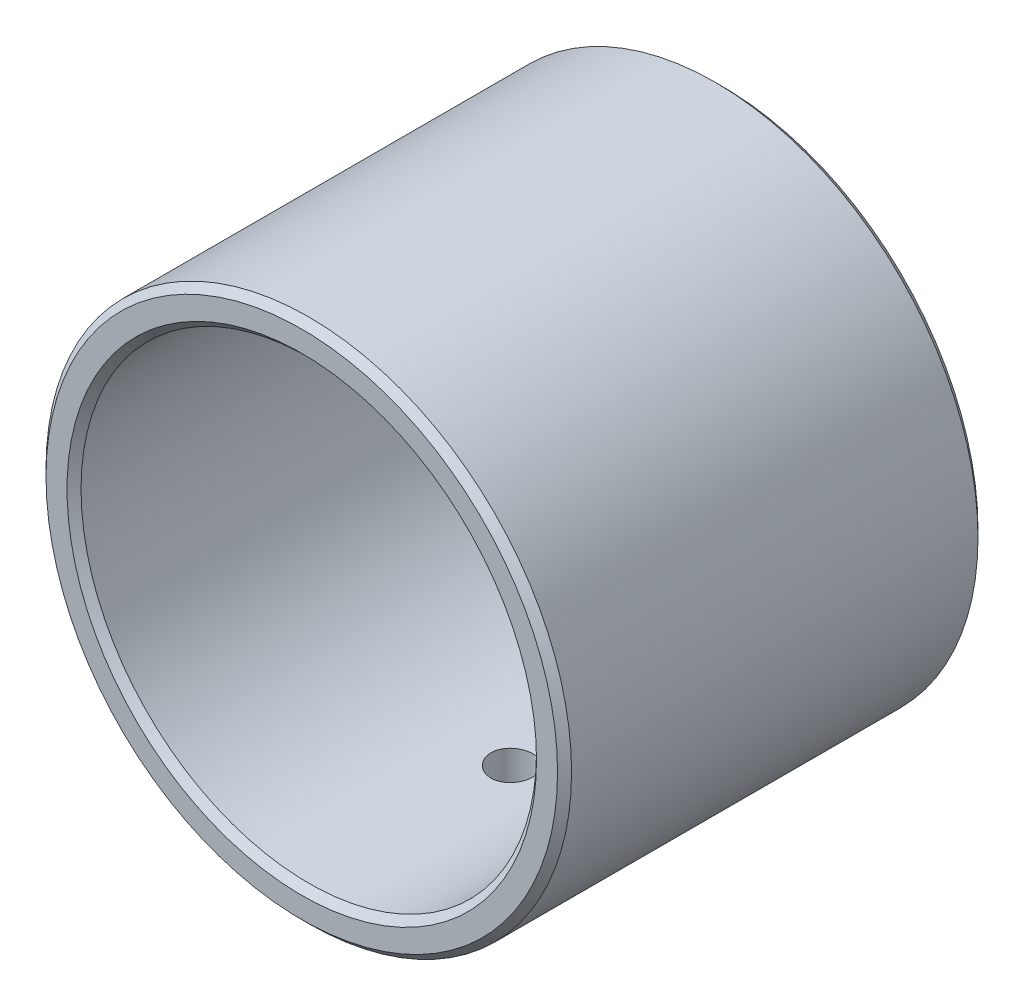
from build123d import *

# Parameters (mm, degrees)
SKETCH_1_R          = 37.5
SKETCH_1_R_2        = 32.5
EXTRUDE_1_DEPTH     = 30
CHAMFER_1_SIZE      = 1
SKETCH_2_R          = 3
CUT_EXTRUDE_1_DEPTH = 61.930288035


with BuildPart() as part:
    # 草图1 → 凸台-拉伸1 (new, symmetric)
    with BuildSketch(Plane.XY):
        Circle(SKETCH_1_R)
        Circle(SKETCH_1_R_2, mode=Mode.SUBTRACT)
    extrude(amount=EXTRUDE_1_DEPTH, both=True)

    # 倒角1
    chamfer_1_edges = [part.edges().sort_by_distance(p)[0] for p in [
        (-37.5, 0, -30),
        (-37.5, 0, 30),
        (-32.5, 0, -30),
        (-32.5, 0, 30),
    ]]
    chamfer(chamfer_1_edges, length=CHAMFER_1_SIZE)

    # 草图2 → 切除-拉伸1 (cut, through all)
    with BuildSketch(Plane(origin=(0, 0, 0), x_dir=(1, 0, 0), z_dir=(0, 1, 0))):
        with Locations(Location((0, 0, 0), (0, 0, 270))):
            Circle(SKETCH_2_R)
    extrude(amount=-CUT_EXTRUDE_1_DEPTH, mode=Mode.SUBTRACT)


solid = part.part
